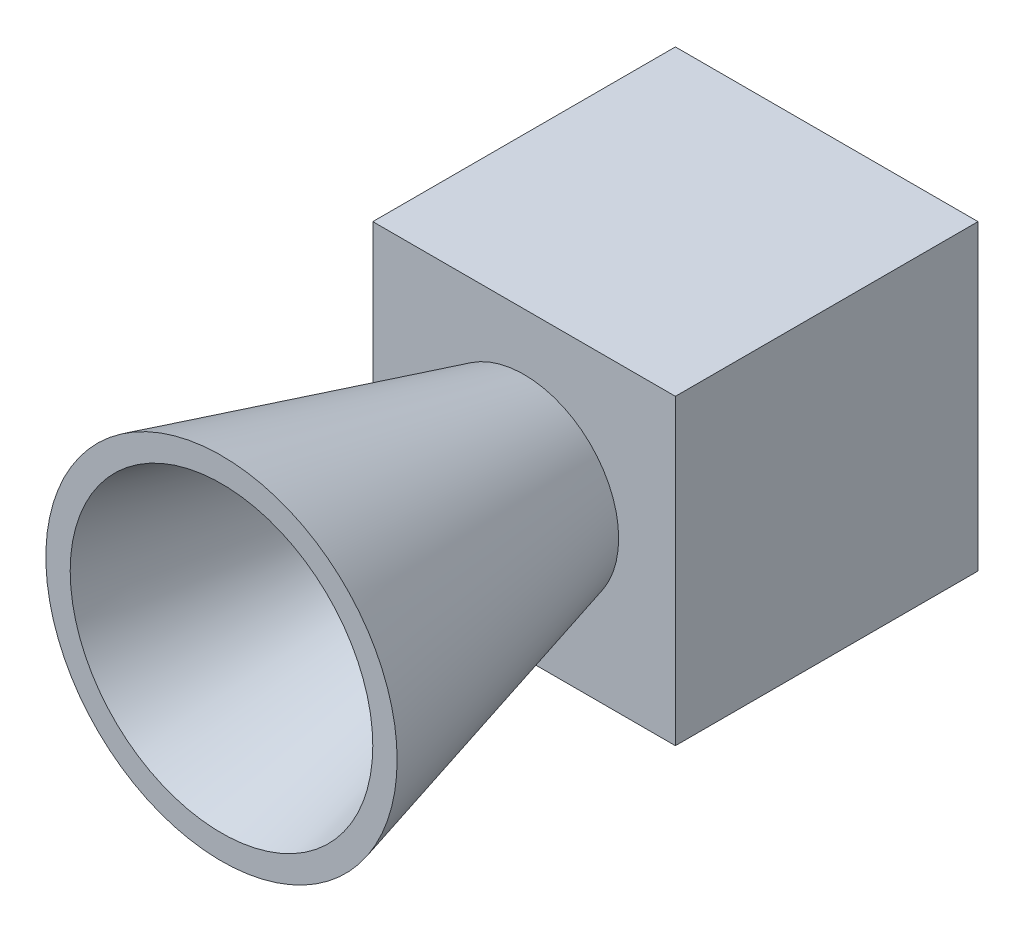
from build123d import *

# Parameters (mm, degrees)
SKETCH1_W           = 1219.2
SKETCH1_H           = 1219.2
BOSS_EXTRUDE1_DEPTH = 1219.2
SKETCH2_R           = 381
BOSS_EXTRUDE2_DEPTH = 1219.2
BOSS_EXTRUDE2_DRAFT = -15
SKETCH3_R           = 609.6
CUT_EXTRUDE1_DEPTH  = 1219.2
CUT_EXTRUDE1_DRAFT  = -15
CUT_EXTRUDE2_START  = -38.1
SKETCH4_W           = 1066.8
SKETCH4_H           = 1066.8
CUT_EXTRUDE2_DEPTH  = 1066.8


with BuildPart() as part:
    # Sketch1 → Boss-Extrude1 (new body)
    with BuildSketch(Plane.XY):
        Rectangle(SKETCH1_W, SKETCH1_H)
    extrude(amount=BOSS_EXTRUDE1_DEPTH)


with BuildPart() as boss_extrude2_tool:
    # Sketch2 → Boss-Extrude2 (with draft: the straight prism first)
    with BuildSketch(Plane.XY.offset(1219.2)):
        Circle(SKETCH2_R)
    extrude(amount=BOSS_EXTRUDE2_DEPTH)
    # Boss-Extrude2: the draft: its side faces are tilted about the plane it starts from
    boss_extrude2_sides = [boss_extrude2_tool.faces().sort_by_distance(p)[0] for p in [
        (-381, 0, 1828.8),
    ]]
    draft(boss_extrude2_sides, Plane.XY.offset(1219.2), BOSS_EXTRUDE2_DRAFT)


with BuildPart() as part_1:
    add(part.part)

    # Boss-Extrude2: add boss_extrude2_tool
    add(boss_extrude2_tool.part)


with BuildPart() as cut_extrude1_tool:
    # Sketch3 → Cut-Extrude1 (with draft: the straight prism first)
    with BuildSketch(Plane.XY.offset(2438.4)):
        Circle(SKETCH3_R)
    extrude(amount=-CUT_EXTRUDE1_DEPTH)
    # Cut-Extrude1: the draft: its side faces are tilted about the plane it starts from
    cut_extrude1_sides = [cut_extrude1_tool.faces().sort_by_distance(p)[0] for p in [
        (-609.6, 0, 1828.8),
    ]]
    draft(cut_extrude1_sides, Plane.XY.offset(2438.4), CUT_EXTRUDE1_DRAFT)


with BuildPart() as part_2:
    add(part_1.part)

    # Cut-Extrude1: cut by cut_extrude1_tool
    add(cut_extrude1_tool.part, mode=Mode.SUBTRACT)

    # Sketch4 → Cut-Extrude2 (cut)
    with BuildSketch(Plane(origin=(0, 0, 0), x_dir=(-1, 0, 0), z_dir=(0, 0, -1)).offset(CUT_EXTRUDE2_START)):
        Rectangle(SKETCH4_W, SKETCH4_H)
    extrude(amount=-CUT_EXTRUDE2_DEPTH, mode=Mode.SUBTRACT)


solid = part_2.part
